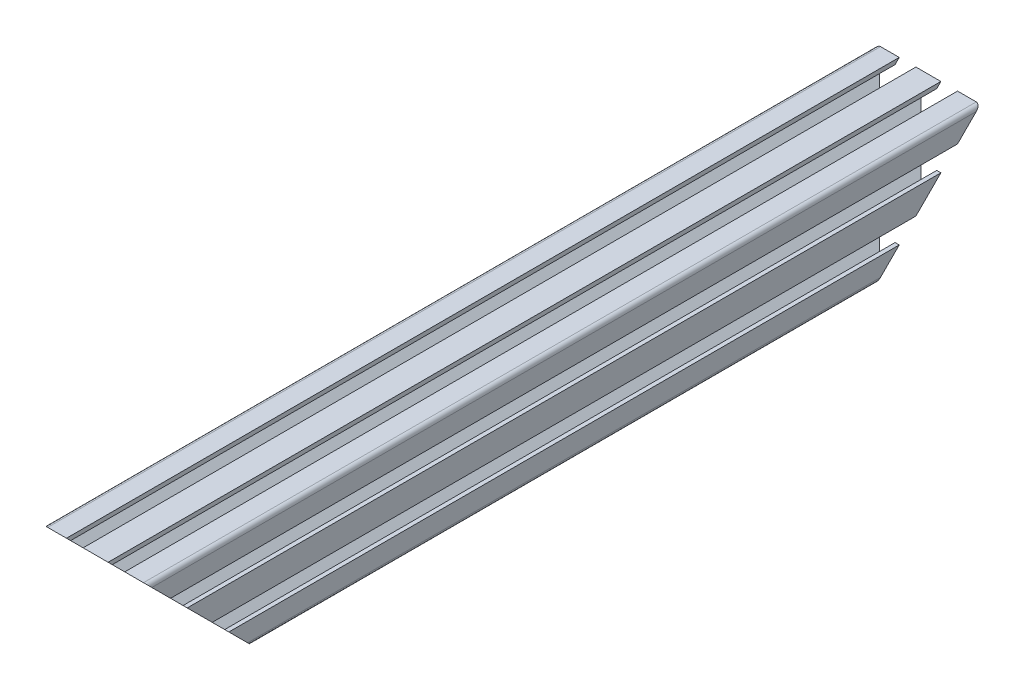
from build123d import *

# Parameters (mm, degrees)
BOSS_EXTRUDE1_DEPTH = 400
CUT_EXTRUDE1_DEPTH  = 402.559460105
CUT_EXTRUDE2_DEPTH  = 402.559460105
CUT_EXTRUDE3_DEPTH  = 402.559460105
CUT_EXTRUDE4_DEPTH  = 402.559460105
CUT_EXTRUDE5_DEPTH  = 404.887360535


with BuildPart() as part:
    # Sketch1 → Boss-Extrude1 (new body)
    with BuildSketch(Plane.XY):
        with BuildLine():
            Line((-25, 23), (-25, 14))
            Line((-25, 14), (-23, 14))
            Line((-23, 14), (-23, 18.25))
            Line((-23, 18.25), (-19.664213562, 18.25))
            Line((-19.664213562, 18.25), (-16, 14.585786438))
            Line((-16, 14.585786438), (-16, 10.653589838))
            ThreePointArc((-16, 10.653589838), (-15.982962913, 10.524180316), (-15.933012702, 10.403589838))
            Line((-15.933012702, 10.403589838), (-15.7, 10))
            Line((-15.7, 10), (-15.933012702, 9.596410162))
            ThreePointArc((-15.933012702, 9.596410162), (-16, 9.346410162), (-15.933012702, 9.096410162))
            Line((-15.933012702, 9.096410162), (-15.750976592, 8.781114371))
            Line((-15.750976592, 8.781114371), (-16, 7.5))
            Line((-16, 7.5), (-16, 5.414213562))
            Line((-16, 5.414213562), (-19.664213562, 1.75))
            Line((-19.664213562, 1.75), (-23, 1.75))
            Line((-23, 1.75), (-23, 6))
            Line((-23, 6), (-25, 6))
            Line((-25, 6), (-25, -6))
            Line((-25, -6), (-23, -6))
            Line((-23, -6), (-23, -1.75))
            Line((-23, -1.75), (-19.664213562, -1.75))
            Line((-19.664213562, -1.75), (-16, -5.414213562))
            Line((-16, -5.414213562), (-16, -9.346410162))
            ThreePointArc((-16, -9.346410162), (-15.982962913, -9.475819684), (-15.933012702, -9.596410162))
            Line((-15.933012702, -9.596410162), (-15.7, -10))
            Line((-15.7, -10), (-15.933012702, -10.403589838))
            ThreePointArc((-15.933012702, -10.403589838), (-16, -10.653589838), (-15.933012702, -10.903589838))
            Line((-15.933012702, -10.903589838), (-15.750976592, -11.218885629))
            Line((-15.750976592, -11.218885629), (-16, -12.5))
            Line((-16, -12.5), (-16, -14.585786438))
            Line((-16, -14.585786438), (-19.664213562, -18.25))
            Line((-19.664213562, -18.25), (-23, -18.25))
            Line((-23, -18.25), (-23, -14))
            Line((-23, -14), (-25, -14))
            Line((-25, -14), (-25, -23))
            ThreePointArc((-25, -23), (-24.414213562, -24.414213562), (-23, -25))
            Line((-23, -25), (-14, -25))
            Line((-14, -25), (-14, -23))
            Line((-14, -23), (-18.25, -23))
            Line((-18.25, -23), (-18.25, -19.664213562))
            Line((-18.25, -19.664213562), (-14.585786438, -16))
            Line((-14.585786438, -16), (-10.653589838, -16))
            ThreePointArc((-10.653589838, -16), (-10.524180316, -15.982962913), (-10.403589838, -15.933012702))
            Line((-10.403589838, -15.933012702), (-10, -15.7))
            Line((-10, -15.7), (-9.596410162, -15.933012702))
            ThreePointArc((-9.596410162, -15.933012702), (-9.346410162, -16), (-9.096410162, -15.933012702))
            Line((-9.096410162, -15.933012702), (-8.781114371, -15.750976592))
            Line((-8.781114371, -15.750976592), (-7.5, -16))
            Line((-7.5, -16), (-5.414213562, -16))
            Line((-5.414213562, -16), (-1.75, -19.664213562))
            Line((-1.75, -19.664213562), (-1.75, -23))
            Line((-1.75, -23), (-6, -23))
            Line((-6, -23), (-6, -25))
            Line((-6, -25), (6, -25))
            Line((6, -25), (6, -23))
            Line((6, -23), (1.75, -23))
            Line((1.75, -23), (1.75, -19.664213562))
            Line((1.75, -19.664213562), (5.414213562, -16))
            Line((5.414213562, -16), (9.346410162, -16))
            ThreePointArc((9.346410162, -16), (9.475819684, -15.982962913), (9.596410162, -15.933012702))
            Line((9.596410162, -15.933012702), (10, -15.7))
            Line((10, -15.7), (10.403589838, -15.933012702))
            ThreePointArc((10.403589838, -15.933012702), (10.653589838, -16), (10.903589838, -15.933012702))
            Line((10.903589838, -15.933012702), (11.218885629, -15.750976592))
            Line((11.218885629, -15.750976592), (12.5, -16))
            Line((12.5, -16), (14.585786438, -16))
            Line((14.585786438, -16), (18.25, -19.664213562))
            Line((18.25, -19.664213562), (18.25, -23))
            Line((18.25, -23), (14, -23))
            Line((14, -23), (14, -25))
            Line((14, -25), (23, -25))
            ThreePointArc((23, -25), (24.414213562, -24.414213562), (25, -23))
            Line((25, -23), (25, -14))
            Line((25, -14), (23, -14))
            Line((23, -14), (23, -18.25))
            Line((23, -18.25), (19.664213562, -18.25))
            Line((19.664213562, -18.25), (16, -14.585786438))
            Line((16, -14.585786438), (16, -10.653589838))
            ThreePointArc((16, -10.653589838), (15.982962913, -10.524180316), (15.933012702, -10.403589838))
            Line((15.933012702, -10.403589838), (15.7, -10))
            Line((15.7, -10), (15.933012702, -9.596410162))
            ThreePointArc((15.933012702, -9.596410162), (16, -9.346410162), (15.933012702, -9.096410162))
            Line((15.933012702, -9.096410162), (15.750976592, -8.781114371))
            Line((15.750976592, -8.781114371), (16, -7.5))
            Line((16, -7.5), (16, -5.414213562))
            Line((16, -5.414213562), (19.664213562, -1.75))
            Line((19.664213562, -1.75), (23, -1.75))
            Line((23, -1.75), (23, -6))
            Line((23, -6), (25, -6))
            Line((25, -6), (25, 6))
            Line((25, 6), (23, 6))
            Line((23, 6), (23, 1.75))
            Line((23, 1.75), (19.664213562, 1.75))
            Line((19.664213562, 1.75), (16, 5.414213562))
            Line((16, 5.414213562), (16, 9.346410162))
            ThreePointArc((16, 9.346410162), (15.982962913, 9.475819684), (15.933012702, 9.596410162))
            Line((15.933012702, 9.596410162), (15.7, 10))
            Line((15.7, 10), (15.933012702, 10.403589838))
            ThreePointArc((15.933012702, 10.403589838), (16, 10.653589838), (15.933012702, 10.903589838))
            Line((15.933012702, 10.903589838), (15.750976592, 11.218885629))
            Line((15.750976592, 11.218885629), (16, 12.5))
            Line((16, 12.5), (16, 14.585786438))
            Line((16, 14.585786438), (19.664213562, 18.25))
            Line((19.664213562, 18.25), (23, 18.25))
            Line((23, 18.25), (23, 14))
            Line((23, 14), (25, 14))
            Line((25, 14), (25, 23))
            ThreePointArc((25, 23), (24.414213562, 24.414213562), (23, 25))
            Line((23, 25), (14, 25))
            Line((14, 25), (14, 23))
            Line((14, 23), (18.25, 23))
            Line((18.25, 23), (18.25, 19.664213562))
            Line((18.25, 19.664213562), (14.585786438, 16))
            Line((14.585786438, 16), (10.653589838, 16))
            ThreePointArc((10.653589838, 16), (10.524180316, 15.982962913), (10.403589838, 15.933012702))
            Line((10.403589838, 15.933012702), (10, 15.7))
            Line((10, 15.7), (9.596410162, 15.933012702))
            ThreePointArc((9.596410162, 15.933012702), (9.346410162, 16), (9.096410162, 15.933012702))
            Line((9.096410162, 15.933012702), (8.781114371, 15.750976592))
            Line((8.781114371, 15.750976592), (7.5, 16))
            Line((7.5, 16), (5.414213562, 16))
            Line((5.414213562, 16), (1.75, 19.664213562))
            Line((1.75, 19.664213562), (1.75, 23))
            Line((1.75, 23), (6, 23))
            Line((6, 23), (6, 25))
            Line((6, 25), (-6, 25))
            Line((-6, 25), (-6, 23))
            Line((-6, 23), (-1.75, 23))
            Line((-1.75, 23), (-1.75, 19.664213562))
            Line((-1.75, 19.664213562), (-5.414213562, 16))
            Line((-5.414213562, 16), (-9.346410162, 16))
            ThreePointArc((-9.346410162, 16), (-9.475819684, 15.982962913), (-9.596410162, 15.933012702))
            Line((-9.596410162, 15.933012702), (-10, 15.7))
            Line((-10, 15.7), (-10.403589838, 15.933012702))
            ThreePointArc((-10.403589838, 15.933012702), (-10.653589838, 16), (-10.903589838, 15.933012702))
            Line((-10.903589838, 15.933012702), (-11.218885629, 15.750976592))
            Line((-11.218885629, 15.750976592), (-12.5, 16))
            Line((-12.5, 16), (-14.585786438, 16))
            Line((-14.585786438, 16), (-18.25, 19.664213562))
            Line((-18.25, 19.664213562), (-18.25, 23))
            Line((-18.25, 23), (-14, 23))
            Line((-14, 23), (-14, 25))
            Line((-14, 25), (-23, 25))
            ThreePointArc((-23, 25), (-24.414213562, 24.414213562), (-25, 23))
        make_face()
        with BuildLine():
            Line((-17.878679656, -0.707106781), (-14.878679656, -3.707106781))
            ThreePointArc((-14.878679656, -3.707106781), (-14.554256308, -3.923879533), (-14.171572875, -4))
            Line((-14.171572875, -4), (-10, -4))
            ThreePointArc((-10, -4), (-5.757359313, -5.757359313), (-4, -10))
            Line((-4, -10), (-4, -14.171572875))
            ThreePointArc((-4, -14.171572875), (-3.923879533, -14.554256308), (-3.707106781, -14.878679656))
            Line((-3.707106781, -14.878679656), (-0.707106781, -17.878679656))
            ThreePointArc((-0.707106781, -17.878679656), (0, -18.171572875), (0.707106781, -17.878679656))
            Line((0.707106781, -17.878679656), (3.707106781, -14.878679656))
            ThreePointArc((3.707106781, -14.878679656), (3.923879533, -14.554256308), (4, -14.171572875))
            Line((4, -14.171572875), (4, -10))
            ThreePointArc((4, -10), (5.757359313, -5.757359313), (10, -4))
            Line((10, -4), (14.171572875, -4))
            ThreePointArc((14.171572875, -4), (14.554256308, -3.923879533), (14.878679656, -3.707106781))
            Line((14.878679656, -3.707106781), (17.878679656, -0.707106781))
            ThreePointArc((17.878679656, -0.707106781), (18.171572875, 0), (17.878679656, 0.707106781))
            Line((17.878679656, 0.707106781), (14.878679656, 3.707106781))
            ThreePointArc((14.878679656, 3.707106781), (14.554256308, 3.923879533), (14.171572875, 4))
            Line((14.171572875, 4), (10, 4))
            ThreePointArc((10, 4), (5.757359313, 5.757359313), (4, 10))
            Line((4, 10), (4, 14.171572875))
            ThreePointArc((4, 14.171572875), (3.923879533, 14.554256308), (3.707106781, 14.878679656))
            Line((3.707106781, 14.878679656), (0.707106781, 17.878679656))
            ThreePointArc((0.707106781, 17.878679656), (0, 18.171572875), (-0.707106781, 17.878679656))
            Line((-0.707106781, 17.878679656), (-3.707106781, 14.878679656))
            ThreePointArc((-3.707106781, 14.878679656), (-3.923879533, 14.554256308), (-4, 14.171572875))
            Line((-4, 14.171572875), (-4, 10))
            ThreePointArc((-4, 10), (-5.757359313, 5.757359313), (-10, 4))
            Line((-10, 4), (-14.171572875, 4))
            ThreePointArc((-14.171572875, 4), (-14.554256308, 3.923879533), (-14.878679656, 3.707106781))
            Line((-14.878679656, 3.707106781), (-17.878679656, 0.707106781))
            ThreePointArc((-17.878679656, 0.707106781), (-18.171572875, 0), (-17.878679656, -0.707106781))
        make_face(mode=Mode.SUBTRACT)
    extrude(amount=-BOSS_EXTRUDE1_DEPTH)

    # Sketch2 → Cut-Extrude1 (cut, through all)
    with BuildSketch(Plane.XY):
        with BuildLine():
            Line((-14.242640687, 12.828427125), (-13.205105981, 11.790892418))
            ThreePointArc((-13.205105981, 11.790892418), (-13.095045749, 11.583064884), (-13.120796199, 11.349307631))
            ThreePointArc((-13.120796199, 11.349307631), (-13.4, 10.000000021), (-13.120796216, 8.650692407))
            ThreePointArc((-13.120796216, 8.650692407), (-13.095045745, 8.416935137), (-13.205105981, 8.209107582))
            Line((-13.205105981, 8.209107582), (-14.242640687, 7.171572875))
            ThreePointArc((-14.242640687, 7.171572875), (-14.389087297, 6.818019485), (-14.242640687, 6.464466094))
            Line((-14.242640687, 6.464466094), (-13.535533906, 5.757359313))
            ThreePointArc((-13.535533906, 5.757359313), (-13.181980515, 5.610912703), (-12.828427125, 5.757359313))
            Line((-12.828427125, 5.757359313), (-11.790892418, 6.794894019))
            ThreePointArc((-11.790892418, 6.794894019), (-11.583064884, 6.904954251), (-11.349307631, 6.879203801))
            ThreePointArc((-11.349307631, 6.879203801), (-7.595836944, 7.595836944), (-6.879203801, 11.349307631))
            ThreePointArc((-6.879203801, 11.349307631), (-6.904954251, 11.583064884), (-6.794894019, 11.790892418))
            Line((-6.794894019, 11.790892418), (-5.757359313, 12.828427125))
            ThreePointArc((-5.757359313, 12.828427125), (-5.610912703, 13.181980515), (-5.757359313, 13.535533906))
            Line((-5.757359313, 13.535533906), (-6.464466094, 14.242640687))
            ThreePointArc((-6.464466094, 14.242640687), (-6.818019485, 14.389087297), (-7.171572875, 14.242640687))
            Line((-7.171572875, 14.242640687), (-8.209107582, 13.205105981))
            ThreePointArc((-8.209107582, 13.205105981), (-8.416935116, 13.095045749), (-8.650692369, 13.120796199))
            ThreePointArc((-8.650692369, 13.120796199), (-9.999999979, 13.4), (-11.349307593, 13.120796216))
            ThreePointArc((-11.349307593, 13.120796216), (-11.583064863, 13.095045745), (-11.790892418, 13.205105981))
            Line((-11.790892418, 13.205105981), (-12.828427125, 14.242640687))
            ThreePointArc((-12.828427125, 14.242640687), (-13.181980515, 14.389087297), (-13.535533906, 14.242640687))
            Line((-13.535533906, 14.242640687), (-14.242640687, 13.535533906))
            ThreePointArc((-14.242640687, 13.535533906), (-14.389087297, 13.181980515), (-14.242640687, 12.828427125))
        make_face()
    extrude(amount=-CUT_EXTRUDE1_DEPTH, mode=Mode.SUBTRACT)

    # Sketch3 → Cut-Extrude2 (cut, through all)
    with BuildSketch(Plane.XY):
        with BuildLine():
            Line((-12.828427125, -14.242640687), (-11.790892418, -13.205105981))
            ThreePointArc((-11.790892418, -13.205105981), (-11.583064884, -13.095045749), (-11.349307631, -13.120796199))
            ThreePointArc((-11.349307631, -13.120796199), (-10.000000021, -13.4), (-8.650692407, -13.120796216))
            ThreePointArc((-8.650692407, -13.120796216), (-8.416935137, -13.095045745), (-8.209107582, -13.205105981))
            Line((-8.209107582, -13.205105981), (-7.171572875, -14.242640687))
            ThreePointArc((-7.171572875, -14.242640687), (-6.818019485, -14.389087297), (-6.464466094, -14.242640687))
            Line((-6.464466094, -14.242640687), (-5.757359313, -13.535533906))
            ThreePointArc((-5.757359313, -13.535533906), (-5.610912703, -13.181980515), (-5.757359313, -12.828427125))
            Line((-5.757359313, -12.828427125), (-6.794894019, -11.790892418))
            ThreePointArc((-6.794894019, -11.790892418), (-6.904954251, -11.583064884), (-6.879203801, -11.349307631))
            ThreePointArc((-6.879203801, -11.349307631), (-7.595836944, -7.595836944), (-11.349307631, -6.879203801))
            ThreePointArc((-11.349307631, -6.879203801), (-11.583064884, -6.904954251), (-11.790892418, -6.794894019))
            Line((-11.790892418, -6.794894019), (-12.828427125, -5.757359313))
            ThreePointArc((-12.828427125, -5.757359313), (-13.181980515, -5.610912703), (-13.535533906, -5.757359313))
            Line((-13.535533906, -5.757359313), (-14.242640687, -6.464466094))
            ThreePointArc((-14.242640687, -6.464466094), (-14.389087297, -6.818019485), (-14.242640687, -7.171572875))
            Line((-14.242640687, -7.171572875), (-13.205105981, -8.209107582))
            ThreePointArc((-13.205105981, -8.209107582), (-13.095045749, -8.416935116), (-13.120796199, -8.650692369))
            ThreePointArc((-13.120796199, -8.650692369), (-13.4, -9.999999979), (-13.120796216, -11.349307593))
            ThreePointArc((-13.120796216, -11.349307593), (-13.095045745, -11.583064863), (-13.205105981, -11.790892418))
            Line((-13.205105981, -11.790892418), (-14.242640687, -12.828427125))
            ThreePointArc((-14.242640687, -12.828427125), (-14.389087297, -13.181980515), (-14.242640687, -13.535533906))
            Line((-14.242640687, -13.535533906), (-13.535533906, -14.242640687))
            ThreePointArc((-13.535533906, -14.242640687), (-13.181980515, -14.389087297), (-12.828427125, -14.242640687))
        make_face()
    extrude(amount=-CUT_EXTRUDE2_DEPTH, mode=Mode.SUBTRACT)

    # Sketch4 → Cut-Extrude3 (cut, through all)
    with BuildSketch(Plane.XY):
        with BuildLine():
            Line((14.242640687, -12.828427125), (13.205105981, -11.790892418))
            ThreePointArc((13.205105981, -11.790892418), (13.095045749, -11.583064884), (13.120796199, -11.349307631))
            ThreePointArc((13.120796199, -11.349307631), (13.4, -10.000000021), (13.120796216, -8.650692407))
            ThreePointArc((13.120796216, -8.650692407), (13.095045745, -8.416935137), (13.205105981, -8.209107582))
            Line((13.205105981, -8.209107582), (14.242640687, -7.171572875))
            ThreePointArc((14.242640687, -7.171572875), (14.389087297, -6.818019485), (14.242640687, -6.464466094))
            Line((14.242640687, -6.464466094), (13.535533906, -5.757359313))
            ThreePointArc((13.535533906, -5.757359313), (13.181980515, -5.610912703), (12.828427125, -5.757359313))
            Line((12.828427125, -5.757359313), (11.790892418, -6.794894019))
            ThreePointArc((11.790892418, -6.794894019), (11.583064884, -6.904954251), (11.349307631, -6.879203801))
            ThreePointArc((11.349307631, -6.879203801), (7.595836944, -7.595836944), (6.879203801, -11.349307631))
            ThreePointArc((6.879203801, -11.349307631), (6.904954251, -11.583064884), (6.794894019, -11.790892418))
            Line((6.794894019, -11.790892418), (5.757359313, -12.828427125))
            ThreePointArc((5.757359313, -12.828427125), (5.610912703, -13.181980515), (5.757359313, -13.535533906))
            Line((5.757359313, -13.535533906), (6.464466094, -14.242640687))
            ThreePointArc((6.464466094, -14.242640687), (6.818019485, -14.389087297), (7.171572875, -14.242640687))
            Line((7.171572875, -14.242640687), (8.209107582, -13.205105981))
            ThreePointArc((8.209107582, -13.205105981), (8.416935116, -13.095045749), (8.650692369, -13.120796199))
            ThreePointArc((8.650692369, -13.120796199), (9.999999979, -13.4), (11.349307593, -13.120796216))
            ThreePointArc((11.349307593, -13.120796216), (11.583064863, -13.095045745), (11.790892418, -13.205105981))
            Line((11.790892418, -13.205105981), (12.828427125, -14.242640687))
            ThreePointArc((12.828427125, -14.242640687), (13.181980515, -14.389087297), (13.535533906, -14.242640687))
            Line((13.535533906, -14.242640687), (14.242640687, -13.535533906))
            ThreePointArc((14.242640687, -13.535533906), (14.389087297, -13.181980515), (14.242640687, -12.828427125))
        make_face()
    extrude(amount=-CUT_EXTRUDE3_DEPTH, mode=Mode.SUBTRACT)

    # Sketch5 → Cut-Extrude4 (cut, through all)
    with BuildSketch(Plane.XY):
        with BuildLine():
            Line((12.828427125, 14.242640687), (11.790892418, 13.205105981))
            ThreePointArc((11.790892418, 13.205105981), (11.583064884, 13.095045749), (11.349307631, 13.120796199))
            ThreePointArc((11.349307631, 13.120796199), (10.000000021, 13.4), (8.650692407, 13.120796216))
            ThreePointArc((8.650692407, 13.120796216), (8.416935137, 13.095045745), (8.209107582, 13.205105981))
            Line((8.209107582, 13.205105981), (7.171572875, 14.242640687))
            ThreePointArc((7.171572875, 14.242640687), (6.818019485, 14.389087297), (6.464466094, 14.242640687))
            Line((6.464466094, 14.242640687), (5.757359313, 13.535533906))
            ThreePointArc((5.757359313, 13.535533906), (5.610912703, 13.181980515), (5.757359313, 12.828427125))
            Line((5.757359313, 12.828427125), (6.794894019, 11.790892418))
            ThreePointArc((6.794894019, 11.790892418), (6.904954251, 11.583064884), (6.879203801, 11.349307631))
            ThreePointArc((6.879203801, 11.349307631), (7.595836944, 7.595836944), (11.349307631, 6.879203801))
            ThreePointArc((11.349307631, 6.879203801), (11.583064884, 6.904954251), (11.790892418, 6.794894019))
            Line((11.790892418, 6.794894019), (12.828427125, 5.757359313))
            ThreePointArc((12.828427125, 5.757359313), (13.181980515, 5.610912703), (13.535533906, 5.757359313))
            Line((13.535533906, 5.757359313), (14.242640687, 6.464466094))
            ThreePointArc((14.242640687, 6.464466094), (14.389087297, 6.818019485), (14.242640687, 7.171572875))
            Line((14.242640687, 7.171572875), (13.205105981, 8.209107582))
            ThreePointArc((13.205105981, 8.209107582), (13.095045749, 8.416935116), (13.120796199, 8.650692369))
            ThreePointArc((13.120796199, 8.650692369), (13.4, 9.999999979), (13.120796216, 11.349307593))
            ThreePointArc((13.120796216, 11.349307593), (13.095045745, 11.583064863), (13.205105981, 11.790892418))
            Line((13.205105981, 11.790892418), (14.242640687, 12.828427125))
            ThreePointArc((14.242640687, 12.828427125), (14.389087297, 13.181980515), (14.242640687, 13.535533906))
            Line((14.242640687, 13.535533906), (13.535533906, 14.242640687))
            ThreePointArc((13.535533906, 14.242640687), (13.181980515, 14.389087297), (12.828427125, 14.242640687))
        make_face()
    extrude(amount=-CUT_EXTRUDE4_DEPTH, mode=Mode.SUBTRACT)

    # Sketch6 → Cut-Extrude5 (cut, through all)
    with BuildSketch(Plane(origin=(25, 0, 0), x_dir=(0, 0, -1), z_dir=(1, 0, 0))):
        Polygon((0, 25), (50, -25), (0, -25), align=None)
        Polygon((400, 25), (350, -25), (400, -25), align=None)
    extrude(amount=-CUT_EXTRUDE5_DEPTH, mode=Mode.SUBTRACT)


solid = part.part
